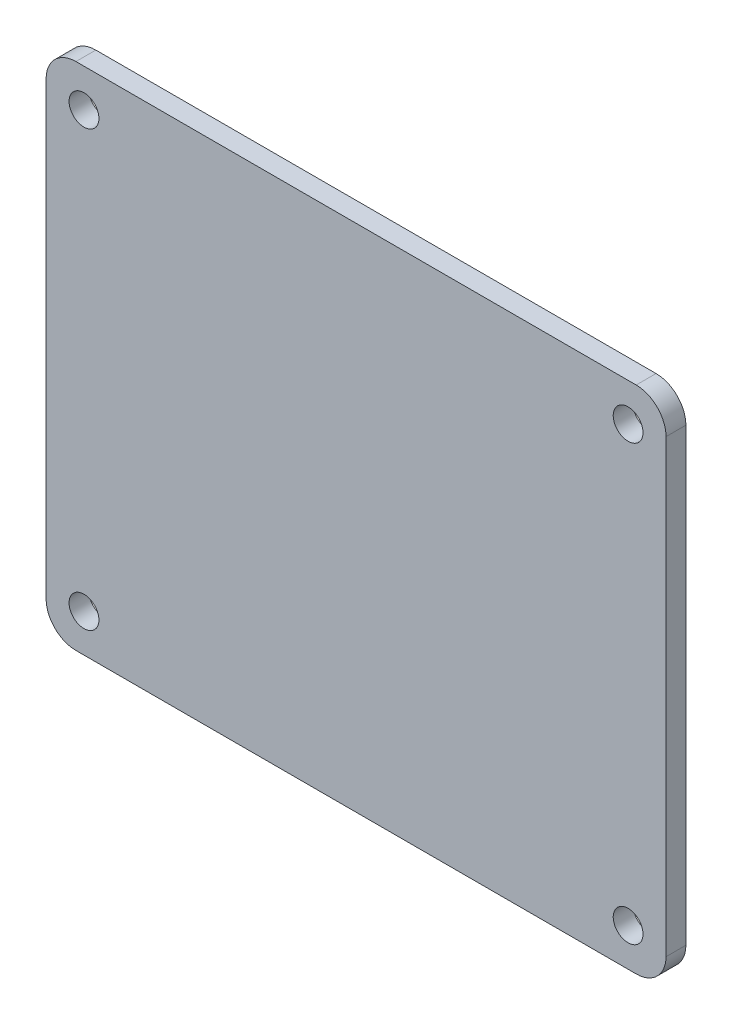
from build123d import *

# Parameters (mm, degrees)
EXTRUDE_2_DEPTH     = 2
SKETCH_3_R          = 1.5
CUT_EXTRUDE_1_DEPTH = 2


with BuildPart() as part:
    # 草图1 → 凸台-拉伸2 (new body)
    with BuildSketch(Plane.XY):
        with BuildLine():
            Line((-23.659696587, 12.547047464), (32.700303413, 12.547047464))
            ThreePointArc((32.700303413, 12.547047464), (34.821623757, 11.668367808), (35.700303413, 9.547047464))
            Line((35.700303413, 9.547047464), (35.700303413, -35.762952536))
            ThreePointArc((35.700303413, -35.762952536), (34.821623757, -37.884272879), (32.700303413, -38.762952536))
            Line((32.700303413, -38.762952536), (-23.659696587, -38.762952536))
            ThreePointArc((-23.659696587, -38.762952536), (-25.78101693, -37.884272879), (-26.659696587, -35.762952536))
            Line((-26.659696587, -35.762952536), (-26.659696587, 9.547047464))
            ThreePointArc((-26.659696587, 9.547047464), (-25.78101693, 11.668367808), (-23.659696587, 12.547047464))
        make_face()
    extrude(amount=EXTRUDE_2_DEPTH)

    # 草图3 → 切除-拉伸1 (cut)
    with BuildSketch(Plane.XY.offset(2)):
        with Locations((-22.849696587, 8.737047464)):
            Circle(SKETCH_3_R)
        with Locations((31.890303413, 8.737047464)):
            Circle(SKETCH_3_R)
        with Locations((-22.849696587, -34.952952536)):
            Circle(SKETCH_3_R)
        with Locations((31.890303413, -34.952952536)):
            Circle(SKETCH_3_R)
    extrude(amount=-CUT_EXTRUDE_1_DEPTH, mode=Mode.SUBTRACT)


solid = part.part
